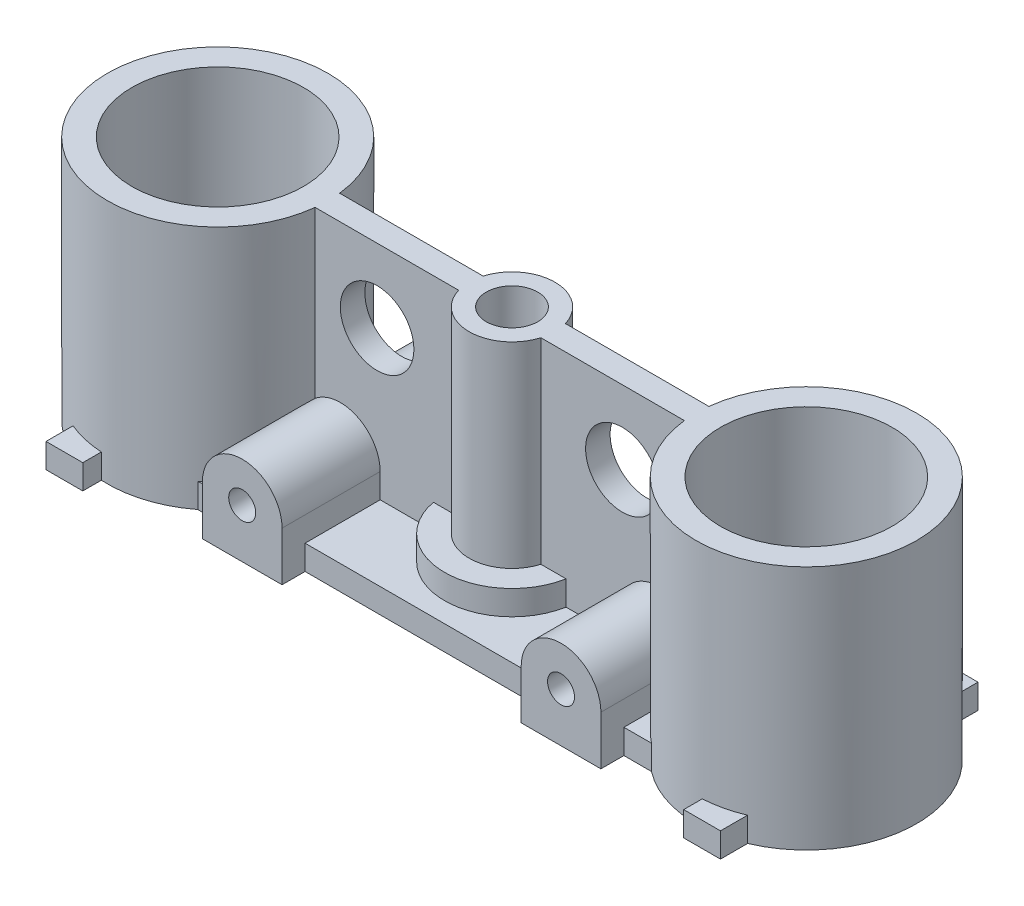
from build123d import *

# Parameters (mm, degrees)
BOSS_EXTRUDE1_DEPTH     = 10
SKETCH2_W               = 18.5
SKETCH2_H               = 7.123903424
SKETCH2_R               = 1.05
BOSS_EXTRUDE2_DEPTH     = 1
SKETCH3_R               = 3.5
CUT_EXTRUDE1_DEPTH      = 8.5
BOSS_EXTRUDE3_DEPTH     = 4.5
SKETCH5_R               = 1.5
CUT_EXTRUDE2_DEPTH      = 4.5
M1_4X0_3_TAPPED_HOLE1_D = 1.1
SKETCH7_R               = 2.75
SKETCH7_R_2             = 1.75
BOSS_EXTRUDE4_DEPTH     = 1
SKETCH8_R               = 2
CUT_EXTRUDE3_DEPTH      = 1


with BuildPart() as part:
    # Sketch1 → Boss-Extrude1 (new body)
    with BuildSketch(Plane(origin=(0, 0, 0), x_dir=(1, 0, 0), z_dir=(0, 1, 0))):
        with BuildLine():
            ThreePointArc((10.063508327, -0.5), (10, 0), (10.063508327, 0.5))
            Line((10.063508327, 0.5), (7.527864045, 0.5))
            ThreePointArc((7.527864045, 0.5), (7.5, 0), (7.527864045, -0.5))
            Line((7.527864045, -0.5), (10.063508327, -0.5))
        make_face()
        with BuildLine():
            Line((7.527864045, 0.5), (10.063508327, 0.5))
            ThreePointArc((10.063508327, 0.5), (12.252008585, 1.984059393), (14, 0))
            ThreePointArc((14, 0), (12.252008585, -1.984059393), (10.063508327, -0.5))
            Line((10.063508327, -0.5), (7.527864045, -0.5))
            ThreePointArc((7.527864045, -0.5), (12.250387902, -4.493028589), (16.5, 0))
            ThreePointArc((16.5, 0), (12.250387902, 4.493028589), (7.527864045, 0.5))
        make_face()
        with BuildLine():
            ThreePointArc((-7.5, 0), (-7.506971411, 0.250387902), (-7.527864045, 0.5))
            Line((-7.527864045, 0.5), (-10.063508327, 0.5))
            ThreePointArc((-10.063508327, 0.5), (-10.015940607, 0.252008585), (-10, 0))
            ThreePointArc((-10, 0), (-10.015940607, -0.252008585), (-10.063508327, -0.5))
            Line((-10.063508327, -0.5), (-7.527864045, -0.5))
            ThreePointArc((-7.527864045, -0.5), (-7.506971411, -0.250387902), (-7.5, 0))
        make_face()
        with BuildLine():
            Line((-10.063508327, 0.5), (-7.527864045, 0.5))
            ThreePointArc((-7.527864045, 0.5), (-16.5, 0), (-7.527864045, -0.5))
            Line((-7.527864045, -0.5), (-10.063508327, -0.5))
            ThreePointArc((-10.063508327, -0.5), (-14, 0), (-10.063508327, 0.5))
        make_face()
        with BuildLine():
            ThreePointArc((7.527864045, -0.5), (7.5, 0), (7.527864045, 0.5))
            Line((7.527864045, 0.5), (1.677050983, 0.5))
            ThreePointArc((1.677050983, 0.5), (1.731666715, 0.252646769), (1.75, 0))
            ThreePointArc((1.75, 0), (1.731666715, -0.252646769), (1.677050983, -0.5))
            Line((1.677050983, -0.5), (7.527864045, -0.5))
        make_face()
        with BuildLine():
            ThreePointArc((-1.677050983, -0.5), (-1.75, 0), (-1.677050983, 0.5))
            Line((-1.677050983, 0.5), (-7.527864045, 0.5))
            ThreePointArc((-7.527864045, 0.5), (-7.506971411, 0.250387902), (-7.5, 0))
            ThreePointArc((-7.5, 0), (-7.506971411, -0.250387902), (-7.527864045, -0.5))
            Line((-7.527864045, -0.5), (-1.677050983, -0.5))
        make_face()
        with BuildLine():
            ThreePointArc((1.75, 0), (1.731666715, 0.252646769), (1.677050983, 0.5))
            Line((1.677050983, 0.5), (0.923309266, 0.5))
            ThreePointArc((0.923309266, 0.5), (1.017834645, 0.257900437), (1.05, 0))
            ThreePointArc((1.05, 0), (1.017834645, -0.257900437), (0.923309266, -0.5))
            Line((0.923309266, -0.5), (1.677050983, -0.5))
            ThreePointArc((1.677050983, -0.5), (1.731666715, -0.252646769), (1.75, 0))
        make_face()
        with BuildLine():
            Line((-0.923309266, 0.5), (-1.677050983, 0.5))
            ThreePointArc((-1.677050983, 0.5), (-1.75, 0), (-1.677050983, -0.5))
            Line((-1.677050983, -0.5), (-0.923309266, -0.5))
            ThreePointArc((-0.923309266, -0.5), (-1.05, 0), (-0.923309266, 0.5))
        make_face()
        with BuildLine():
            Line((0.923309266, 0.5), (1.677050983, 0.5))
            ThreePointArc((1.677050983, 0.5), (0, 1.75), (-1.677050983, 0.5))
            Line((-1.677050983, 0.5), (-0.923309266, 0.5))
            ThreePointArc((-0.923309266, 0.5), (0, 1.05), (0.923309266, 0.5))
        make_face()
        with BuildLine():
            ThreePointArc((-1.677050983, -0.5), (0, -1.75), (1.677050983, -0.5))
            Line((1.677050983, -0.5), (0.923309266, -0.5))
            ThreePointArc((0.923309266, -0.5), (0, -1.05), (-0.923309266, -0.5))
            Line((-0.923309266, -0.5), (-1.677050983, -0.5))
        make_face()
    extrude(amount=BOSS_EXTRUDE1_DEPTH)

    # Sketch2 → Boss-Extrude2 (add)
    # profile 1 of 5: a face of its own
    with BuildSketch(Plane(origin=(0, 0, 0), x_dir=(1, 0, 0), z_dir=(0, 1, 0))):
        with BuildLine():
            Line((-12.25, 5.25), (-13.75, 5.25))
            Line((-13.75, 5.25), (-13.75, 0.968245837))
            ThreePointArc((-13.75, 0.968245837), (-13.121649841, 1.655868846), (-12.25, 1.984313483))
            Line((-12.25, 1.984313483), (-12.25, 5.25))
        make_face()
    # profile 2 of 5: a face of its own
    with BuildSketch(Plane(origin=(0, 0, 0), x_dir=(1, 0, 0), z_dir=(0, 1, 0))):
        with BuildLine():
            ThreePointArc((-12.25, -1.984313483), (-13.121649841, -1.655868846), (-13.75, -0.968245837))
            Line((-13.75, -0.968245837), (-13.75, -5.25))
            Line((-13.75, -5.25), (-12.25, -5.25))
            Line((-12.25, -5.25), (-12.25, -1.984313483))
        make_face()
    # profile 3 of 5: a face of its own
    with BuildSketch(Plane(origin=(0, 0, 0), x_dir=(1, 0, 0), z_dir=(0, 1, 0))):
        with BuildLine():
            Line((13.75, 5.25), (12.25, 5.25))
            Line((12.25, 5.25), (12.25, 1.984313483))
            ThreePointArc((12.25, 1.984313483), (13.121649841, 1.655868846), (13.75, 0.968245837))
            Line((13.75, 0.968245837), (13.75, 5.25))
        make_face()
    # profile 4 of 5: a face of its own
    with BuildSketch(Plane(origin=(0, 0, 0), x_dir=(1, 0, 0), z_dir=(0, 1, 0))):
        with BuildLine():
            ThreePointArc((13.75, -0.968245837), (13.121649841, -1.655868846), (12.25, -1.984313483))
            Line((12.25, -1.984313483), (12.25, -5.25))
            Line((12.25, -5.25), (13.75, -5.25))
            Line((13.75, -5.25), (13.75, -0.968245837))
        make_face()
    # profile 5 of 5: a face of its own
    with BuildSketch(Plane(origin=(0, 0, 0), x_dir=(1, 0, 0), z_dir=(0, 1, 0))):
        Rectangle(SKETCH2_W, SKETCH2_H)
        with Locations(Location((0, 0, 0), (0, 0, 270))):
            Circle(SKETCH2_R, mode=Mode.SUBTRACT)
    extrude(amount=BOSS_EXTRUDE2_DEPTH)

    # Sketch3 → Cut-Extrude1 (cut)
    with BuildSketch(Plane(origin=(0, 10, 0), x_dir=(1, 0, 0), z_dir=(0, 1, 0))):
        with Locations(Location((-12, 0, 0), (0, 0, 270))):
            Circle(SKETCH3_R)
        with Locations(Location((12, 0, 0), (0, 0, 270))):
            Circle(SKETCH3_R)
    extrude(amount=-CUT_EXTRUDE1_DEPTH, mode=Mode.SUBTRACT)

    # Sketch4 → Boss-Extrude3 (add, symmetric)
    with BuildSketch(Plane.XY):
        with BuildLine():
            Line((-8.125, 0), (-4.875, 0))
            Line((-4.875, 0), (-4.875, 2))
            ThreePointArc((-4.875, 2), (-6.5, 3.625), (-8.125, 2))
            Line((-8.125, 2), (-8.125, 0))
        make_face()
        with BuildLine():
            Line((8.125, 0), (4.875, 0))
            Line((4.875, 0), (4.875, 2))
            ThreePointArc((4.875, 2), (6.5, 3.625), (8.125, 2))
            Line((8.125, 2), (8.125, 0))
        make_face()
    extrude(amount=BOSS_EXTRUDE3_DEPTH, both=True)

    # Sketch5 → Cut-Extrude2 (cut, symmetric)
    with BuildSketch(Plane.XY):
        with Locations((-5, 7)):
            Circle(SKETCH5_R)
        with Locations((5, 7)):
            Circle(SKETCH5_R)
    extrude(amount=CUT_EXTRUDE2_DEPTH, both=True, mode=Mode.SUBTRACT)

    # M1.4x0.3 Tapped Hole1 (through all)
    with Locations(Plane(origin=(-6.5, 2, 4.5), x_dir=(1, 0, 0), z_dir=(0, 0, 1))):
        with Locations((0, 0), (13, 0)):
            Hole(M1_4X0_3_TAPPED_HOLE1_D / 2)

    # Sketch7 → Boss-Extrude4 (add)
    with BuildSketch(Plane(origin=(0, 1, 0), x_dir=(1, 0, 0), z_dir=(0, 1, 0))):
        Circle(SKETCH7_R)
        Circle(SKETCH7_R_2, mode=Mode.SUBTRACT)
    extrude(amount=BOSS_EXTRUDE4_DEPTH)

    # Sketch8 → Cut-Extrude3 (cut)
    with BuildSketch(Plane.XZ):
        with Locations(Location((0, 0, 0), (0, 0, 270))):
            Circle(SKETCH8_R)
    extrude(amount=-CUT_EXTRUDE3_DEPTH, mode=Mode.SUBTRACT)


solid = part.part
